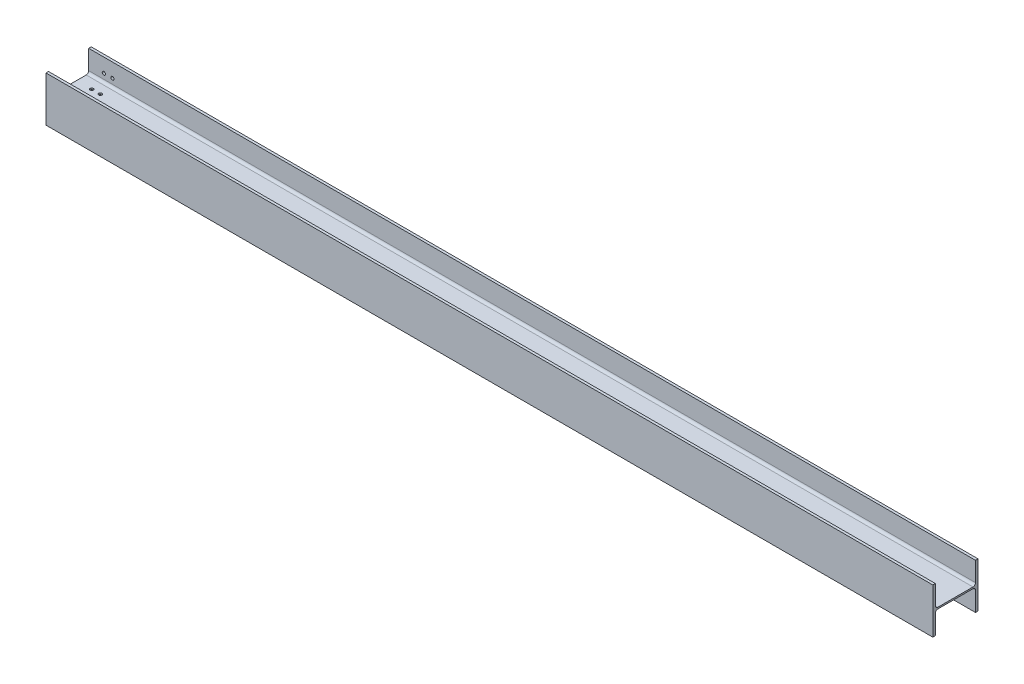
from build123d import *

# Parameters (mm, degrees)
UNIVERSAL_COLUMN_ICS_250UC72_9_1_DEPTH = 5000
SKETCH3_R                              = 9
CUT_EXTRUDE2_DEPTH                     = 14.2
SKETCH20_R                             = 9
CUT_EXTRUDE19_DEPTH                    = 4.3
SKETCH21_W                             = 254
SKETCH21_H                             = 254
CUT_EXTRUDE20_DEPTH                    = 10
SKETCH22_W                             = 282
SKETCH22_H                             = 282
CUT_EXTRUDE21_DEPTH                    = 10


with BuildPart() as part:
    # Sketch1 → Universal Column_ics 250UC72.9(1) (new body)
    with BuildSketch(Plane(origin=(0, 0, 0), x_dir=(0, 1, 0), z_dir=(-1, 0, 0))):
        with BuildLine():
            Line((-127, -127), (127, -127))
            Line((127, -127), (127, -112.8))
            Line((127, -112.8), (18.3, -112.8))
            ThreePointArc((18.3, -112.8), (8.400505063, -108.699494937), (4.3, -98.8))
            Line((4.3, -98.8), (4.3, 98.8))
            ThreePointArc((4.3, 98.8), (8.400505063, 108.699494937), (18.3, 112.8))
            Line((18.3, 112.8), (127, 112.8))
            Line((127, 112.8), (127, 127))
            Line((127, 127), (-127, 127))
            Line((-127, 127), (-127, 112.8))
            Line((-127, 112.8), (-18.3, 112.8))
            ThreePointArc((-18.3, 112.8), (-8.400505063, 108.699494937), (-4.3, 98.8))
            Line((-4.3, 98.8), (-4.3, -98.8))
            ThreePointArc((-4.3, -98.8), (-8.400505063, -108.699494937), (-18.3, -112.8))
            Line((-18.3, -112.8), (-127, -112.8))
            Line((-127, -112.8), (-127, -127))
        make_face()
    extrude(amount=UNIVERSAL_COLUMN_ICS_250UC72_9_1_DEPTH)

    # Sketch3 → Cut-Extrude2 (cut)
    with BuildSketch(Plane(origin=(-4890.5, 0, -127), x_dir=(0, -1, 0), z_dir=(0, 0, -1))):
        with Locations(Location((48, -33.5, 0), (0, 0, 180))):
            Circle(SKETCH3_R)
        with Locations(Location((48, 14.5, 0), (0, 0, 180))):
            Circle(SKETCH3_R)
        with Locations(Location((-48, -33.5, 0), (0, 0, 180))):
            Circle(SKETCH3_R)
        with Locations(Location((-48, 14.5, 0), (0, 0, 180))):
            Circle(SKETCH3_R)
    extrude(amount=-CUT_EXTRUDE2_DEPTH, mode=Mode.SUBTRACT)

    # Sketch20 → Cut-Extrude19 (cut, symmetric)
    with BuildSketch(Plane(origin=(-4890.5, 0, 0), x_dir=(0, 0, -1), z_dir=(0, 1, 0))):
        with Locations(Location((45, -33.5, 0), (0, 0, 90))):
            Circle(SKETCH20_R)
        with Locations(Location((-45, -33.5, 0), (0, 0, 90))):
            Circle(SKETCH20_R)
        with Locations(Location((45, 14.5, 0), (0, 0, 90))):
            Circle(SKETCH20_R)
        with Locations(Location((-45, 14.5, 0), (0, 0, 90))):
            Circle(SKETCH20_R)
    extrude(amount=CUT_EXTRUDE19_DEPTH, both=True, mode=Mode.SUBTRACT)

    # Sketch21 → Cut-Extrude20 (cut)
    with BuildSketch(Plane(origin=(-5000, 0, 0), x_dir=(0, 1, 0), z_dir=(-1, 0, 0))):
        Rectangle(SKETCH21_W, SKETCH21_H)
    extrude(amount=-CUT_EXTRUDE20_DEPTH, mode=Mode.SUBTRACT)

    # Sketch22 → Cut-Extrude21 (cut)
    with BuildSketch(Plane(origin=(0, 0, 0), x_dir=(0, 1, 0), z_dir=(-1, 0, 0))):
        Rectangle(SKETCH22_W, SKETCH22_H)
    extrude(amount=CUT_EXTRUDE21_DEPTH, mode=Mode.SUBTRACT)


solid = part.part
